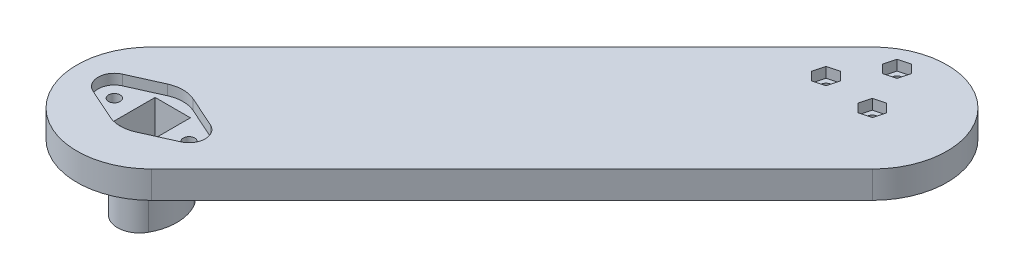
from build123d import *

# Parameters (mm, degrees)
BOSS_EXTRUDE1_DEPTH     = 8
BOSS_EXTRUDE2_START     = 8
SKETCH1_4_W             = 10.4
SKETCH1_4_H             = 12.4
BOSS_EXTRUDE2_DEPTH     = 24.8
CUT_EXTRUDE3_DEPTH      = 177.890212798
CUT_EXTRUDE3_DEPTH_BACK = 182.890212798
CUT_EXTRUDE3_START      = 5
SKETCH1_6_W             = 10.4
SKETCH1_6_H             = 12.4
SKETCH1_6_R             = 1.7
BOSS_EXTRUDE3_START     = -16.8
SKETCH1_10_W            = 11.4
SKETCH1_10_H            = 13.4
SKETCH1_10_W_2          = 10.4
SKETCH1_10_H_2          = 12.4
SKETCH1_10_W_3          = 7
SKETCH1_10_H_3          = 9
BOSS_EXTRUDE3_DEPTH     = 0.7
SKETCH2_R               = 1.7
SKETCH2_W               = 10.4
SKETCH2_H               = 12.4
CUT_EXTRUDE7_DEPTH      = 3
CUT_EXTRUDE5_START      = 8
SKETCH1_8_R             = 1.7
CUT_EXTRUDE5_DEPTH      = 3
CUT_EXTRUDE6_DEPTH      = 3


with BuildPart() as part:
    # Sketch1 → Boss-Extrude1 (new body)
    with BuildSketch(Plane(origin=(0, 0, 0), x_dir=(1, 0, 0), z_dir=(0, 1, 0))):
        with BuildLine():
            Line((-15.556349186, 15.556349186), (90.509667992, 121.622366364))
            ThreePointArc((90.509667992, 121.622366364), (121.622366364, 121.622366364), (121.622366364, 90.509667992))
            Line((121.622366364, 90.509667992), (15.556349186, -15.556349186))
            ThreePointArc((15.556349186, -15.556349186), (-15.556349186, -15.556349186), (-15.556349186, 15.556349186))
        make_face()
    extrude(amount=BOSS_EXTRUDE1_DEPTH)

    # Sketch1<4> → Boss-Extrude2 (add)
    with BuildSketch(Plane(origin=(0, 0, 0), x_dir=(1, 0, 0), z_dir=(0, 1, 0)).offset(BOSS_EXTRUDE2_START)):
        with BuildLine():
            ThreePointArc((-5.7, 6.7), (0, 10.065795515), (5.7, 6.7))
            ThreePointArc((5.7, 6.7), (7.425074212, 0), (5.7, -6.7))
            ThreePointArc((5.7, -6.7), (0, -10.065795515), (-5.7, -6.7))
            ThreePointArc((-5.7, -6.7), (-7.425074212, 0), (-5.7, 6.7))
        make_face()
        Rectangle(SKETCH1_4_W, SKETCH1_4_H, mode=Mode.SUBTRACT)
    extrude(amount=-BOSS_EXTRUDE2_DEPTH)

    # Sketch1<6> → Cut-Extrude3 (cut, two sides: drawn at the far end of the back side and taken through both)
    with BuildSketch(Plane(origin=(0, 0, 0), x_dir=(1, 0, 0), z_dir=(0, 1, 0)).offset(CUT_EXTRUDE3_START - CUT_EXTRUDE3_DEPTH_BACK)):
        Rectangle(SKETCH1_6_W, SKETCH1_6_H)
        with Locations(Location((106.066017178, 106.066017178, 0), (0, 0, 270))):
            Circle(SKETCH1_6_R)
        with Locations(Location((99.718863875, 119.666151183, 0), (0, 0, 270))):
            Circle(SKETCH1_6_R)
        with Locations(Location((91.11521733, 107.378870518, 0), (0, 0, 270))):
            Circle(SKETCH1_6_R)
        with Locations(Location((11, 0, 0), (0, 0, 270))):
            Circle(SKETCH1_6_R)
        with Locations(Location((-11, 0, 0), (0, 0, 270))):
            Circle(SKETCH1_6_R)
    extrude(amount=CUT_EXTRUDE3_DEPTH + CUT_EXTRUDE3_DEPTH_BACK, mode=Mode.SUBTRACT)

    # Sketch1<10> → Boss-Extrude3 (add)
    # profile 1 of 6: a face of its own
    with BuildSketch(Plane(origin=(0, 0, 0), x_dir=(1, 0, 0), z_dir=(0, 1, 0)).offset(BOSS_EXTRUDE3_START)):
        Rectangle(SKETCH1_10_W, SKETCH1_10_H)
        Rectangle(SKETCH1_10_W_2, SKETCH1_10_H_2, mode=Mode.SUBTRACT)
    # profile 2 of 6: a face of its own
    with BuildSketch(Plane(origin=(0, 0, 0), x_dir=(1, 0, 0), z_dir=(0, 1, 0)).offset(BOSS_EXTRUDE3_START)):
        Rectangle(SKETCH1_10_W_2, SKETCH1_10_H_2)
        Rectangle(SKETCH1_10_W_3, SKETCH1_10_H_3, mode=Mode.SUBTRACT)
    # profile 3 of 6: a face of its own
    with BuildSketch(Plane(origin=(0, 0, 0), x_dir=(1, 0, 0), z_dir=(0, 1, 0)).offset(BOSS_EXTRUDE3_START)):
        with BuildLine():
            ThreePointArc((-5.7, 6.7), (0, 10.065795515), (5.7, 6.7))
            Line((5.7, 6.7), (-5.7, 6.7))
        make_face()
    # profile 4 of 6: a face of its own
    with BuildSketch(Plane(origin=(0, 0, 0), x_dir=(1, 0, 0), z_dir=(0, 1, 0)).offset(BOSS_EXTRUDE3_START)):
        with BuildLine():
            Line((5.7, 6.7), (5.7, -6.7))
            ThreePointArc((5.7, -6.7), (7.425074212, 0), (5.7, 6.7))
        make_face()
    # profile 5 of 6: a face of its own
    with BuildSketch(Plane(origin=(0, 0, 0), x_dir=(1, 0, 0), z_dir=(0, 1, 0)).offset(BOSS_EXTRUDE3_START)):
        with BuildLine():
            Line((-5.7, -6.7), (5.7, -6.7))
            ThreePointArc((5.7, -6.7), (0, -10.065795515), (-5.7, -6.7))
        make_face()
    # profile 6 of 6: a face of its own
    with BuildSketch(Plane(origin=(0, 0, 0), x_dir=(1, 0, 0), z_dir=(0, 1, 0)).offset(BOSS_EXTRUDE3_START)):
        with BuildLine():
            Line((-5.7, 6.7), (-5.7, -6.7))
            ThreePointArc((-5.7, -6.7), (-7.425074212, 0), (-5.7, 6.7))
        make_face()
    extrude(amount=-BOSS_EXTRUDE3_DEPTH)

    # Sketch2 → Cut-Extrude7 (cut)
    with BuildSketch(Plane(origin=(0, 8, 0), x_dir=(1, 0, 0), z_dir=(0, 1, 0))):
        with BuildLine():
            ThreePointArc((-3.784090909, -8.440566094), (0, -9.25), (3.784090909, -8.440566094))
            Line((3.784090909, -8.440566094), (12.943181818, -4.334344751))
            ThreePointArc((12.943181818, -4.334344751), (15.75, 0), (12.943181818, 4.334344751))
            Line((12.943181818, 4.334344751), (3.784090909, 8.440566094))
            ThreePointArc((3.784090909, 8.440566094), (0, 9.25), (-3.784090909, 8.440566094))
            Line((-3.784090909, 8.440566094), (-12.943181818, 4.334344751))
            ThreePointArc((-12.943181818, 4.334344751), (-15.75, 0), (-12.943181818, -4.334344751))
            Line((-12.943181818, -4.334344751), (-3.784090909, -8.440566094))
        make_face()
        with Locations(Location((-11, 0, 0), (0, 0, 270))):
            Circle(SKETCH2_R, mode=Mode.SUBTRACT)
        Rectangle(SKETCH2_W, SKETCH2_H, mode=Mode.SUBTRACT)
        with Locations(Location((11, 0, 0), (0, 0, 270))):
            Circle(SKETCH2_R, mode=Mode.SUBTRACT)
    extrude(amount=-CUT_EXTRUDE7_DEPTH, mode=Mode.SUBTRACT)

    # Sketch1<8> → Cut-Extrude5 (cut)
    # profile 1 of 3: a face of its own
    with BuildSketch(Plane(origin=(0, 0, 0), x_dir=(1, 0, 0), z_dir=(0, 1, 0)).offset(CUT_EXTRUDE5_START)):
        Polygon((102.168353618, 117.21666144), (103.06492909, 120.562726655), (100.615439347, 123.012216398), (97.269374132, 122.115640925), (96.37279866, 118.769575711), (98.822288403, 116.320085968), align=None)
        with Locations(Location((99.718863875, 119.666151183, 0), (0, 0, 270))):
            Circle(SKETCH1_8_R, mode=Mode.SUBTRACT)
    # profile 2 of 3: a face of its own
    with BuildSketch(Plane(origin=(0, 0, 0), x_dir=(1, 0, 0), z_dir=(0, 1, 0)).offset(CUT_EXTRUDE5_START)):
        Polygon((88.665727587, 109.828360261), (87.769152115, 106.482295046), (90.218641857, 104.032805303), (93.564707072, 104.929380776), (94.461282545, 108.275445991), (92.011792802, 110.724935733), align=None)
        with Locations(Location((91.11521733, 107.378870518, 0), (0, 0, 270))):
            Circle(SKETCH1_8_R, mode=Mode.SUBTRACT)
    # profile 3 of 3: a face of its own
    with BuildSketch(Plane(origin=(0, 0, 0), x_dir=(1, 0, 0), z_dir=(0, 1, 0)).offset(CUT_EXTRUDE5_START)):
        Polygon((108.515506921, 103.616527435), (109.412082393, 106.96259265), (106.96259265, 109.412082393), (103.616527435, 108.515506921), (102.719951963, 105.169441706), (105.169441706, 102.719951963), align=None)
        with Locations(Location((106.066017178, 106.066017178, 0), (0, 0, 270))):
            Circle(SKETCH1_8_R, mode=Mode.SUBTRACT)
    extrude(amount=-CUT_EXTRUDE5_DEPTH, mode=Mode.SUBTRACT)

    # Sketch1<9> → Cut-Extrude6 (cut)
    with BuildSketch(Plane(origin=(0, 0, 0), x_dir=(1, 0, 0), z_dir=(0, 1, 0))):
        with BuildLine():
            Line((97.232940058, 93.451075696), (-9.918409797, 168.479258594))
            ThreePointArc((-9.918409797, 168.479258594), (-13.700274159, 189.927277196), (7.747744443, 193.709141558))
            Line((7.747744443, 193.709141558), (114.899094298, 118.68095866))
            ThreePointArc((114.899094298, 118.68095866), (118.68095866, 97.232940058), (97.232940058, 93.451075696))
        make_face()
    extrude(amount=CUT_EXTRUDE6_DEPTH, mode=Mode.SUBTRACT)


solid = part.part
